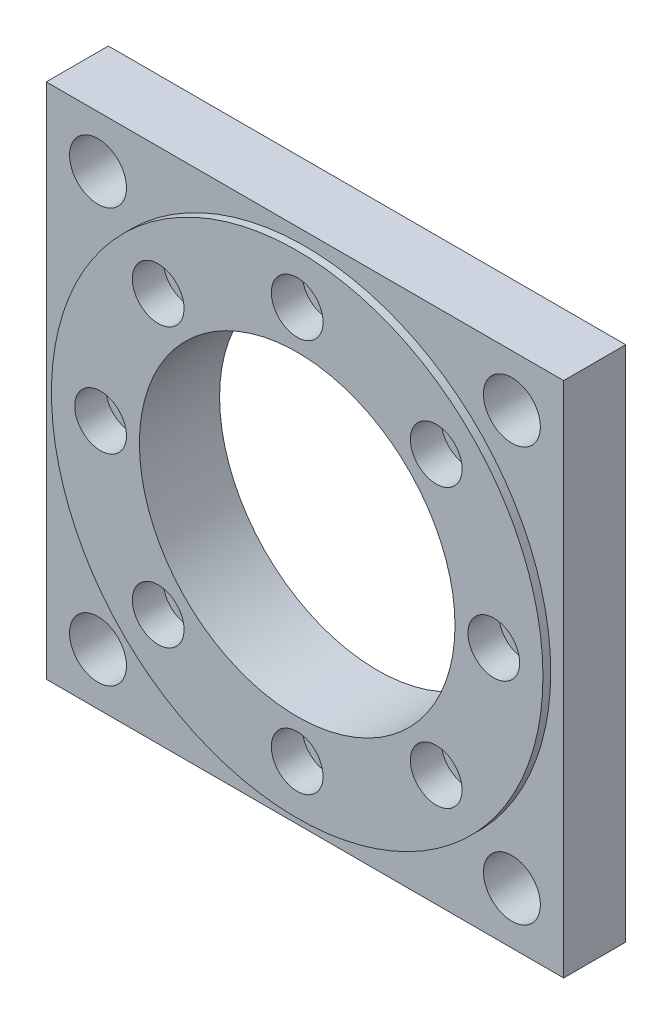
from build123d import *

# Parameters (mm, degrees)
SKETCH_1_R          = 34
EXTRUDE_1_DEPTH     = 2
SKETCH_2_W          = 100
SKETCH_2_H          = 100
EXTRUDE_2_DEPTH     = 12
SKETCH_3_R          = 30.5
CUT_EXTRUDE_1_DEPTH = 73.083285164
SKETCH_4_R          = 3
CUT_EXTRUDE_2_DEPTH = 73.083285164
SKETCH_5_R          = 5
CUT_EXTRUDE_4_DEPTH = 4.5
SKETCH_7_R          = 5.5
CUT_EXTRUDE_6_DEPTH = 50
EXTRUDE_START       = 1.5
SKETCH_8_R          = 47.5
SKETCH_8_R_2        = 5
SKETCH_8_R_3        = 30.5
EXTRUDE_3_DEPTH     = 1.5


with BuildPart() as part:
    # 草图1 → 拉伸1 (new body)
    with BuildSketch(Plane.XY):
        Circle(SKETCH_1_R)
    extrude(amount=EXTRUDE_1_DEPTH)

    # 草图2 → 拉伸2 (add)
    with BuildSketch(Plane.XY.offset(2)):
        Rectangle(SKETCH_2_W, SKETCH_2_H)
    extrude(amount=EXTRUDE_2_DEPTH)

    # 草图3 → 切除-拉伸1 (cut, through all)
    with BuildSketch(Plane(origin=(0, 0, 0), x_dir=(-1, 0, 0), z_dir=(0, 0, -1))):
        Circle(SKETCH_3_R)
    extrude(amount=-CUT_EXTRUDE_1_DEPTH, mode=Mode.SUBTRACT)

    # 草图4 → 切除-拉伸2 (cut, through all)
    with BuildSketch(Plane.XY.offset(14)):
        with Locations((26.870057685, 26.870057685)):
            Circle(SKETCH_4_R)
        with Locations((0, 38)):
            Circle(SKETCH_4_R)
        with Locations((38, 0)):
            Circle(SKETCH_4_R)
        with Locations((26.870057685, -26.870057685)):
            Circle(SKETCH_4_R)
        with Locations((0, -38)):
            Circle(SKETCH_4_R)
        with Locations((-26.870057685, -26.870057685)):
            Circle(SKETCH_4_R)
        with Locations((-38, 0)):
            Circle(SKETCH_4_R)
        with Locations((-26.870057685, 26.870057685)):
            Circle(SKETCH_4_R)
    extrude(amount=-CUT_EXTRUDE_2_DEPTH, mode=Mode.SUBTRACT)

    # 草图5 → 切除-拉伸4 (cut)
    with BuildSketch(Plane.XY.offset(14)):
        with Locations((0, 38)):
            Circle(SKETCH_5_R)
        with Locations((26.870057685, 26.870057685)):
            Circle(SKETCH_5_R)
        with Locations((38, 0)):
            Circle(SKETCH_5_R)
        with Locations((26.870057685, -26.870057685)):
            Circle(SKETCH_5_R)
        with Locations((0, -38)):
            Circle(SKETCH_5_R)
        with Locations((-26.870057685, -26.870057685)):
            Circle(SKETCH_5_R)
        with Locations((-38, 0)):
            Circle(SKETCH_5_R)
        with Locations((-26.870057685, 26.870057685)):
            Circle(SKETCH_5_R)
    extrude(amount=-CUT_EXTRUDE_4_DEPTH, mode=Mode.SUBTRACT)

    # 草图7 → 切除-拉伸6 (cut)
    with BuildSketch(Plane.XY.offset(14)):
        with Locations((-40, 40)):
            Circle(SKETCH_7_R)
        with Locations((40, 40)):
            Circle(SKETCH_7_R)
        with Locations((-40, -40)):
            Circle(SKETCH_7_R)
        with Locations((40, -40)):
            Circle(SKETCH_7_R)
    extrude(amount=-CUT_EXTRUDE_6_DEPTH, mode=Mode.SUBTRACT)

    # 草图8 → 拉伸3 (add)
    with BuildSketch(Plane.XY.offset(14).offset(EXTRUDE_START)):
        Circle(SKETCH_8_R)
        with Locations((26.870057685, 26.870057685)):
            Circle(SKETCH_8_R_2, mode=Mode.SUBTRACT)
        with Locations((0, 38)):
            Circle(SKETCH_8_R_2, mode=Mode.SUBTRACT)
        with Locations((38, 0)):
            Circle(SKETCH_8_R_2, mode=Mode.SUBTRACT)
        with Locations((26.870057685, -26.870057685)):
            Circle(SKETCH_8_R_2, mode=Mode.SUBTRACT)
        with Locations((0, -38)):
            Circle(SKETCH_8_R_2, mode=Mode.SUBTRACT)
        with Locations((-26.870057685, -26.870057685)):
            Circle(SKETCH_8_R_2, mode=Mode.SUBTRACT)
        with Locations((-38, 0)):
            Circle(SKETCH_8_R_2, mode=Mode.SUBTRACT)
        with Locations((-26.870057685, 26.870057685)):
            Circle(SKETCH_8_R_2, mode=Mode.SUBTRACT)
        with Locations(Location((0, 0, 0), (0, 0, 180))):
            Circle(SKETCH_8_R_3, mode=Mode.SUBTRACT)
    extrude(amount=-EXTRUDE_3_DEPTH)


solid = part.part
